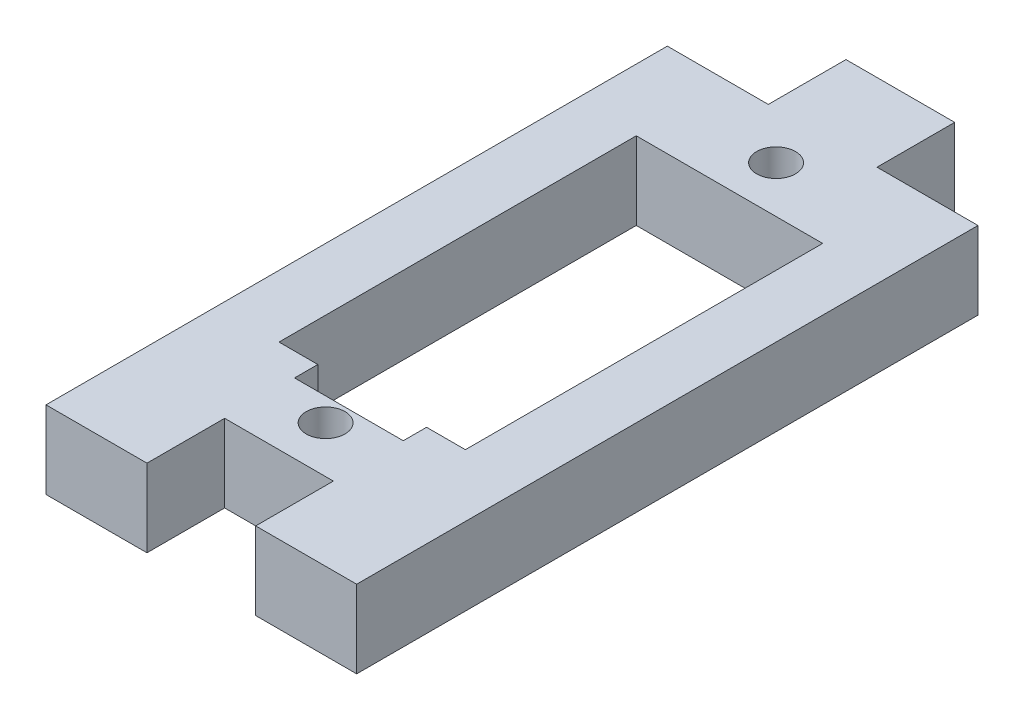
from build123d import *

# Parameters (mm, degrees)
BOSS_EXTRUDE1_DEPTH = 5
SKETCH2_R           = 1.25
CUT_EXTRUDE1_DEPTH  = 5


with BuildPart() as part:
    # Sketch1 → Boss-Extrude1 (new body)
    with BuildSketch(Plane(origin=(0, 0, 0), x_dir=(1, 0, 0), z_dir=(0, 1, 0))):
        Polygon((-10, 20), (-10, -20), (-3.5, -20), (-3.5, -15), (3.5, -15), (3.5, -20), (10, -20), (10, 20), (3.5, 20), (3.5, 25), (-3.5, 25), (-3.5, 20), align=None)
    extrude(amount=BOSS_EXTRUDE1_DEPTH)

    # Sketch2 → Cut-Extrude1 (cut)
    with BuildSketch(Plane(origin=(0, 5, 0), x_dir=(1, 0, 0), z_dir=(0, 1, 0))):
        with Locations(Location((0, 17, 0), (0, 0, 270))):
            Circle(SKETCH2_R)
        with Locations(Location((0, -12, 0), (0, 0, 270))):
            Circle(SKETCH2_R)
        Polygon((-6, 14), (6, 14), (6, -9), (3.5, -9), (3.5, -10.5), (-3.5, -10.5), (-3.5, -9), (-6, -9), align=None)
    extrude(amount=-CUT_EXTRUDE1_DEPTH, mode=Mode.SUBTRACT)


solid = part.part
